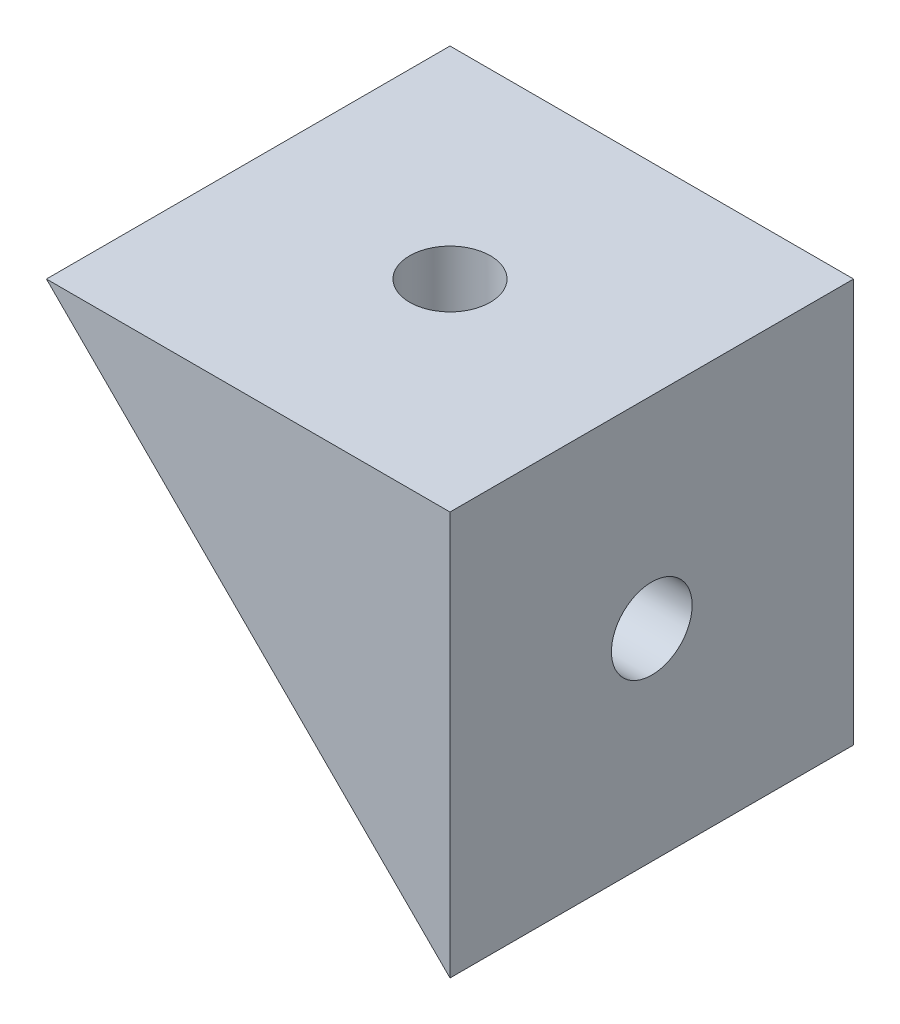
from build123d import *

# Parameters (mm, degrees)
BOSS_EXTRU_1_DEPTH           = 20
ESQUISSE2_R                  = 2
ENL_V_MAT_EXTRU_1_DEPTH      = 35.641016151
ESQUISSE3_R                  = 2
ENL_V_MAT_EXTRU_2_DEPTH      = 35.641016151
ENL_V_MAT_EXTRU_3_DEPTH      = 5
ENL_V_MAT_EXTRU_3_DEPTH_BACK = 5
ESQUISSE6_R                  = 5
ENL_V_MAT_EXTRU_4_DEPTH      = 6
ENL_V_MAT_EXTRU_4_DEPTH_BACK = 5
ESQUISSE9_R                  = 5


with BuildPart() as part:
    # Esquisse1 → Boss.-Extru.1 (new body)
    with BuildSketch(Plane.XY):
        Polygon((0, 0), (-20, 0), (0, -20), align=None)
    extrude(amount=BOSS_EXTRU_1_DEPTH)

    # Esquisse2 → Enlèv. mat.-Extru.1 (cut, through all)
    with BuildSketch(Plane(origin=(0, 0, 0), x_dir=(1, 0, 0), z_dir=(0, 1, 0))):
        with Locations(Location((-10, -10, 0), (0, 0, 180))):
            Circle(ESQUISSE2_R)
    extrude(amount=-ENL_V_MAT_EXTRU_1_DEPTH, mode=Mode.SUBTRACT)

    # Esquisse3 → Enlèv. mat.-Extru.2 (cut, through all)
    with BuildSketch(Plane(origin=(0, 0, 0), x_dir=(0, 0, -1), z_dir=(1, 0, 0))):
        with Locations((-10, -10)):
            Circle(ESQUISSE3_R)
    extrude(amount=-ENL_V_MAT_EXTRU_2_DEPTH, mode=Mode.SUBTRACT)

    # Esquisse6 → Enlèv. mat.-Extru.3 (cut, two sides: drawn at the far end of the back side and taken through both)
    with BuildSketch(Plane(origin=(0, -10, 0), x_dir=(1, 0, 0), z_dir=(0, 1, 0)).offset(-ENL_V_MAT_EXTRU_3_DEPTH_BACK)):
        with Locations((-10.004008989, -9.994708572)):
            Circle(ESQUISSE6_R)
    extrude(amount=ENL_V_MAT_EXTRU_3_DEPTH + ENL_V_MAT_EXTRU_3_DEPTH_BACK, mode=Mode.SUBTRACT)

    # Esquisse9 → Enlèv. mat.-Extru.4 (cut, two sides: drawn at the far end of the back side and taken through both)
    with BuildSketch(Plane(origin=(-10, 0, 0), x_dir=(0, 0, -1), z_dir=(1, 0, 0)).offset(-ENL_V_MAT_EXTRU_4_DEPTH_BACK)):
        with Locations(Location((-9.969497879, -10.041855886, 0), (0, 0, 208.496581374))):
            Circle(ESQUISSE9_R)
    extrude(amount=ENL_V_MAT_EXTRU_4_DEPTH + ENL_V_MAT_EXTRU_4_DEPTH_BACK, mode=Mode.SUBTRACT)


solid = part.part
